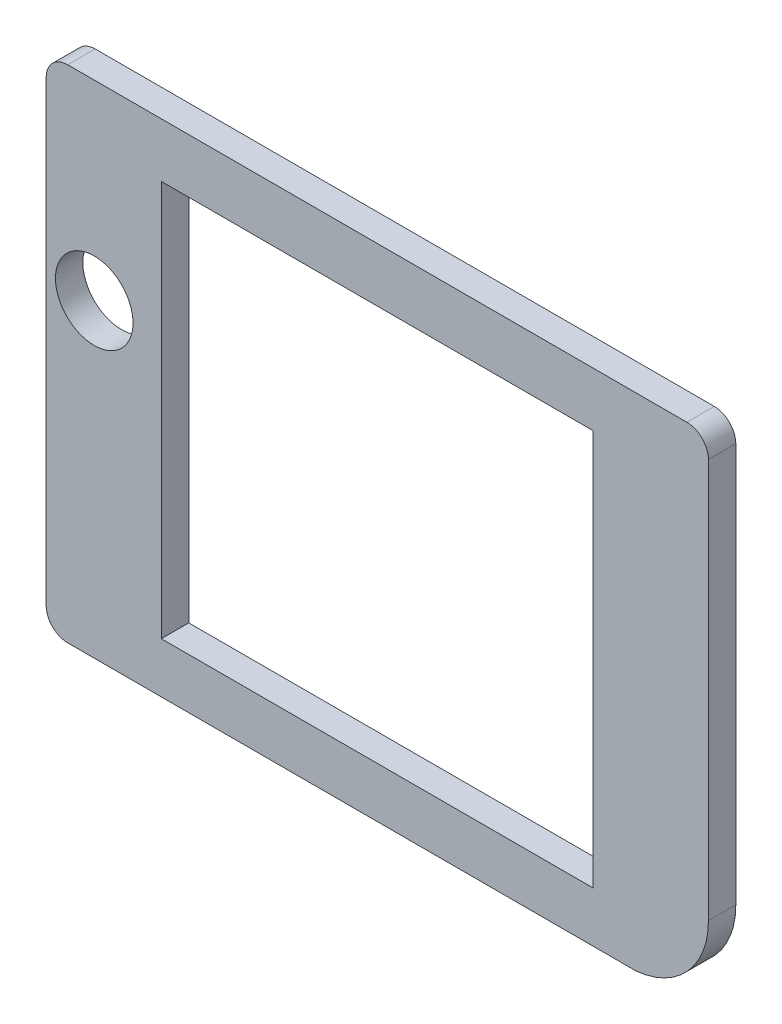
from build123d import *

# Parameters (mm, degrees)
SKETCH1_R   = 4.5
SKETCH1_W   = 50.090098238
SKETCH1_H   = 45.932062837
BEZEL_DEPTH = 3.18


with BuildPart() as part:
    # Sketch1 → Bezel (new body)
    with BuildSketch(Plane.XY):
        with BuildLine():
            Line((-35.919151108, 4.418014642), (29.997375098, 4.418014642))
            ThreePointArc((29.997375098, 4.418014642), (35.990372343, 7.41277043), (38.389642662, 13.668014642))
            Line((38.389642662, 13.668014642), (38.389642662, 59.990077479))
            ThreePointArc((38.389642662, 59.990077479), (37.657409615, 61.757844432), (35.889642662, 62.490077479))
            Line((35.889642662, 62.490077479), (-35.919151108, 62.490077479))
            ThreePointArc((-35.919151108, 62.490077479), (-37.686918061, 61.757844432), (-38.419151108, 59.990077479))
            Line((-38.419151108, 59.990077479), (-38.419151108, 6.918014642))
            ThreePointArc((-38.419151108, 6.918014642), (-37.686918061, 5.150247689), (-35.919151108, 4.418014642))
        make_face()
        with Locations(Location((-32.845865367, 40.325993685, 0), (0, 0, 180))):
            Circle(SKETCH1_R, mode=Mode.SUBTRACT)
        with Locations((-0.014754223, 33.23404606)):
            Rectangle(SKETCH1_W, SKETCH1_H, mode=Mode.SUBTRACT)
    extrude(amount=BEZEL_DEPTH)


solid = part.part
